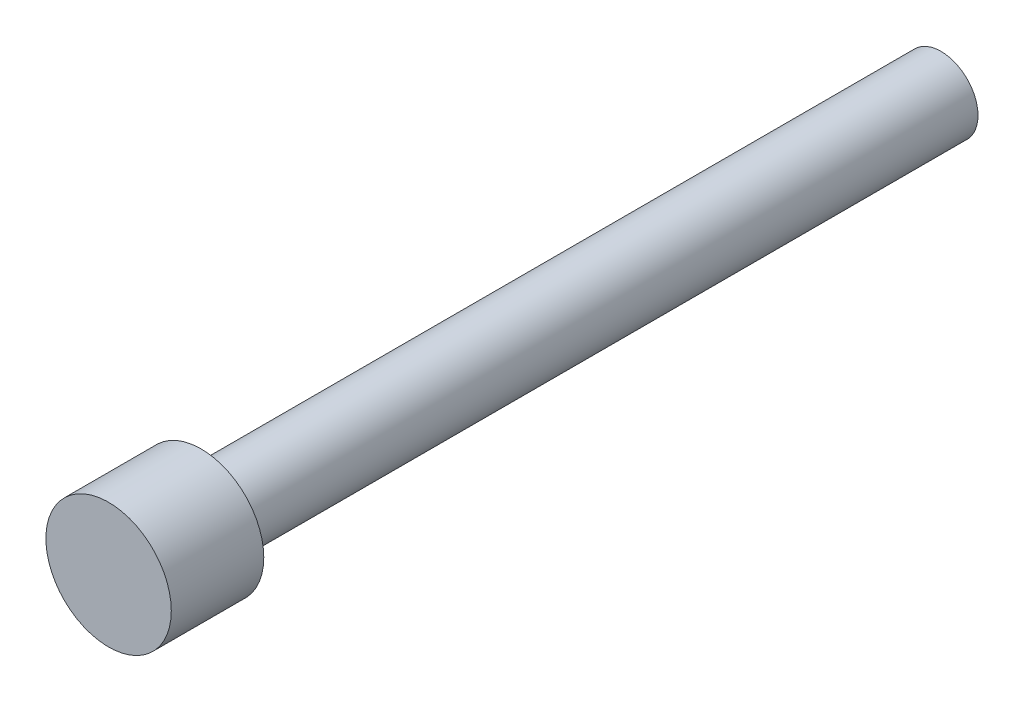
from build123d import *

# Parameters (mm, degrees)
SKETCH1_R           = 2
BOSS_EXTRUDE1_DEPTH = 40
SKETCH2_R           = 3.39
BOSS_EXTRUDE2_DEPTH = 5


with BuildPart() as part:
    # Sketch1 → Boss-Extrude1 (new body)
    with BuildSketch(Plane.XY):
        Circle(SKETCH1_R)
    extrude(amount=BOSS_EXTRUDE1_DEPTH)

    # Sketch2 → Boss-Extrude2 (add)
    with BuildSketch(Plane.XY.offset(40)):
        Circle(SKETCH2_R)
    extrude(amount=BOSS_EXTRUDE2_DEPTH)


solid = part.part
